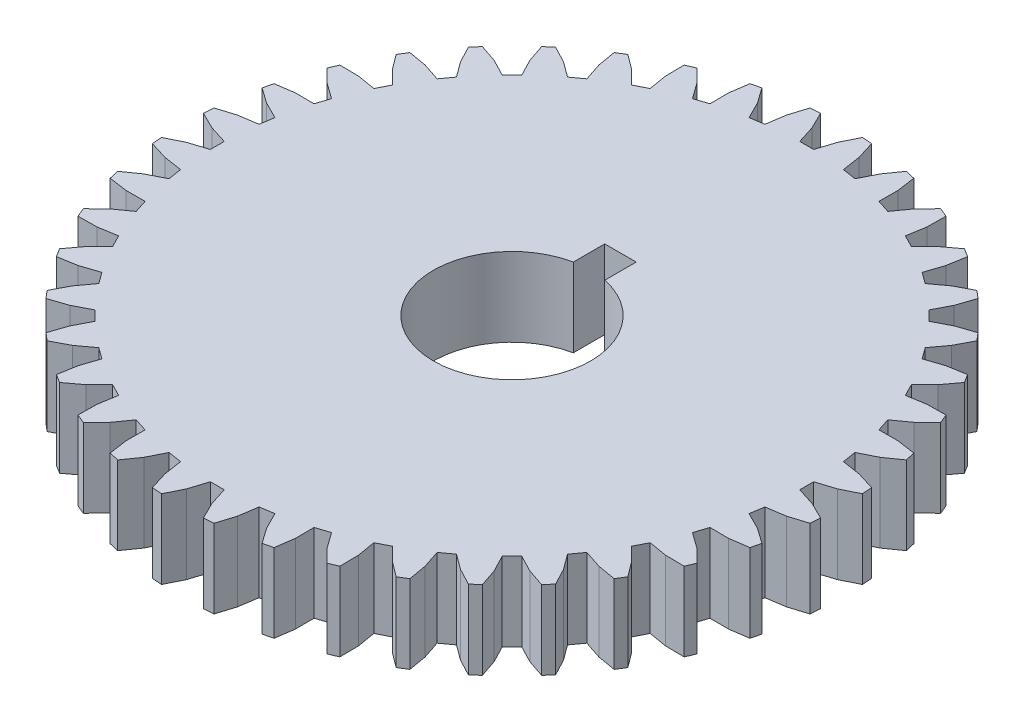
from build123d import *

# Parameters (mm, degrees)
EXTRUDE_1_DEPTH = 10


with BuildPart() as part:
    # 草图1 → 凸台-拉伸1 (new body)
    with BuildSketch(Plane(origin=(0, 0, 0), x_dir=(1, 0, 0), z_dir=(0, 1, 0))):
        Polygon((15.539064442, 62.864868962), (17.218272819, 62.319261086), (18.612038449, 64.263927027), (20.280202174, 65.979018289), (21.449660173, 65.494612926), (21.416477393, 63.102290381), (21.026932048, 60.741662779), (22.600114707, 59.940086178), (24.280933545, 61.642777073), (26.196858791, 63.075794416), (27.276141128, 62.414409349), (26.869125185, 60.056731196), (26.115092273, 57.786105155), (27.543512237, 56.748297304), (29.469996945, 58.167087253), (31.586507273, 59.282745034), (32.549038434, 58.46066576), (31.778211413, 56.195685858), (30.678257727, 54.070971726), (31.926742555, 52.822486899), (34.051456686, 53.922440585), (36.316436588, 54.693267606), (37.138515862, 53.730736445), (36.022858081, 51.614226117), (34.604068132, 49.687741408), (35.641875983, 48.259321445), (37.912502024, 49.013354357), (40.270180178, 49.420370299), (40.931565244, 48.341087963), (39.498547901, 46.425162717), (37.795857006, 44.744343879), (38.597433608, 43.17116122), (40.95806121, 43.560706565), (43.350383754, 43.593889345), (43.834789118, 42.424431346), (42.119697855, 40.756267621), (40.175031914, 39.362501991), (40.72063979, 37.683293614), (43.113142467, 37.698759494), (45.481202481, 37.357292041), (45.776700475, 36.126454317), (43.821766532, 34.747127839), (41.683009675, 33.674734553), (41.959214149, 31.930848142), (44.324680544, 31.571853735), (46.610168532, 30.864144111), (46.709483013, 29.602233971), (44.562843352, 28.545708337), (42.282658871, 27.821093277), (42.282658871, 26.055469102), (44.562843352, 25.330854041), (46.709483013, 24.274328407), (46.610168532, 23.012418267), (44.324680544, 22.304708644), (41.959214149, 21.945714237), (41.683009675, 20.201827825), (43.821766532, 19.129434539), (45.776700475, 17.750108062), (45.481202481, 16.519270337), (43.113142467, 16.177802885), (40.72063979, 16.193268765), (40.175031914, 14.514060387), (42.119697855, 13.120294758), (43.834789118, 11.452131033), (43.350383754, 10.282673033), (40.95806121, 10.315855813), (38.597433608, 10.705401159), (37.795857006, 9.1322185), (39.498547901, 7.451399661), (40.931565244, 5.535474416), (40.270180178, 4.456192079), (37.912502024, 4.863208021), (35.641875983, 5.617240933), (34.604068132, 4.18882097), (36.022858081, 2.262336262), (37.138515862, 0.145825934), (36.316436588, -0.816705228), (34.051456686, -0.045878206), (31.926742555, 1.05407548), (30.678257727, -0.194409348), (31.778211413, -2.319123479), (32.549038434, -4.584103381), (31.586507273, -5.406182655), (29.469996945, -4.290524874), (27.543512237, -2.871734925), (26.115092273, -3.909542776), (26.869125185, -6.180168818), (27.276141128, -8.537846971), (26.196858791, -9.199232038), (24.280933545, -7.766214694), (22.600114707, -6.063523799), (21.026932048, -6.865100401), (21.416477393, -9.225728003), (21.449660173, -11.618050547), (20.280202174, -12.102455911), (18.612038449, -10.387364648), (17.218272819, -8.442698708), (15.539064442, -8.988306584), (15.554530322, -11.38080926), (15.21306287, -13.748869275), (13.982225145, -14.044367268), (12.602898668, -12.089433325), (11.530505382, -9.950676468), (9.78661897, -10.226880942), (9.427624563, -12.592347337), (8.71991494, -14.877835325), (7.458004799, -14.977149807), (6.401479165, -12.830510145), (5.676864105, -10.550325664), (3.91123993, -10.550325664), (3.18662487, -12.830510145), (2.130099236, -14.977149807), (0.868189095, -14.877835325), (0.160479472, -12.592347337), (-0.198514935, -10.226880942), (-1.942401347, -9.950676468), (-3.014794633, -12.089433325), (-4.39412111, -14.044367268), (-5.624958835, -13.748869275), (-5.966426287, -11.38080926), (-5.950960407, -8.988306584), (-7.630168784, -8.442698708), (-9.023934414, -10.387364648), (-10.692098139, -12.102455911), (-11.861556138, -11.618050547), (-11.828373358, -9.225728003), (-11.438828013, -6.865100401), (-13.012010672, -6.063523799), (-14.69282951, -7.766214694), (-16.608754756, -9.199232038), (-17.688037093, -8.537846971), (-17.28102115, -6.180168818), (-16.526988238, -3.909542776), (-17.955408202, -2.871734925), (-19.88189291, -4.290524874), (-21.998403238, -5.406182655), (-22.960934399, -4.584103381), (-22.190107378, -2.319123479), (-21.090153692, -0.194409348), (-22.33863852, 1.05407548), (-24.463352651, -0.045878206), (-26.728332553, -0.816705228), (-27.550411827, 0.145825934), (-26.434754046, 2.262336262), (-25.015964097, 4.18882097), (-26.053771948, 5.617240933), (-28.324397989, 4.863208021), (-30.682076143, 4.456192079), (-31.343461209, 5.535474416), (-29.910443866, 7.451399661), (-28.207752971, 9.1322185), (-29.009329573, 10.705401159), (-31.369957175, 10.315855813), (-33.762279719, 10.282673033), (-34.246685083, 11.452131033), (-32.53159382, 13.120294758), (-30.586927879, 14.514060387), (-31.132535755, 16.193268765), (-33.525038432, 16.177802885), (-35.893098446, 16.519270337), (-36.18859644, 17.750108062), (-34.233662497, 19.129434539), (-32.09490564, 20.201827825), (-32.371110114, 21.945714237), (-34.736576509, 22.304708644), (-37.022064497, 23.012418267), (-37.121378978, 24.274328407), (-34.974739317, 25.330854041), (-32.694554836, 26.055469102), (-32.694554836, 27.821093277), (-34.974739317, 28.545708337), (-37.121378978, 29.602233971), (-37.022064497, 30.864144111), (-34.736576509, 31.571853735), (-32.371110114, 31.930848142), (-32.09490564, 33.674734553), (-34.233662497, 34.747127839), (-36.18859644, 36.126454317), (-35.893098446, 37.357292041), (-33.525038432, 37.698759494), (-31.132535755, 37.683293614), (-30.586927879, 39.362501991), (-32.53159382, 40.756267621), (-34.246685083, 42.424431346), (-33.762279719, 43.593889345), (-31.369957175, 43.560706565), (-29.009329573, 43.17116122), (-28.207752971, 44.744343879), (-29.910443866, 46.425162717), (-31.343461209, 48.341087963), (-30.682076143, 49.420370299), (-28.324397989, 49.013354357), (-26.053771948, 48.259321445), (-25.015964097, 49.687741408), (-26.434754046, 51.614226117), (-27.550411827, 53.730736445), (-26.728332553, 54.693267606), (-24.463352651, 53.922440585), (-22.33863852, 52.822486899), (-21.090153692, 54.070971726), (-22.190107378, 56.195685858), (-22.960934399, 58.46066576), (-21.998403238, 59.282745034), (-19.88189291, 58.167087253), (-17.955408202, 56.748297304), (-16.526988238, 57.786105155), (-17.28102115, 60.056731196), (-17.688037093, 62.414409349), (-16.608754756, 63.075794416), (-14.69282951, 61.642777073), (-13.012010672, 59.940086178), (-11.438828013, 60.741662779), (-11.828373358, 63.102290381), (-11.861556138, 65.494612926), (-10.692098139, 65.979018289), (-9.023934414, 64.263927027), (-7.630168784, 62.319261086), (-5.950960407, 62.864868962), (-5.966426287, 65.257371639), (-5.624958835, 67.625431653), (-4.39412111, 67.920929647), (-3.014794633, 65.965995704), (-1.942401347, 63.827238847), (-0.198514935, 64.10344332), (0.160479472, 66.468909716), (0.868189095, 68.754397703), (2.130099236, 68.853712185), (3.18662487, 66.707072524), (3.91123993, 64.426888043), (5.676864105, 64.426888043), (6.401479165, 66.707072524), (7.458004799, 68.853712185), (8.71991494, 68.754397703), (9.427624563, 66.468909716), (9.78661897, 64.10344332), (11.530505382, 63.827238847), (12.602898668, 65.965995704), (13.982225145, 67.920929647), (15.21306287, 67.625431653), (15.554530322, 65.257371639), align=None)
        with BuildLine():
            Line((6.794052018, 36.73624016), (6.794052018, 40.73624016))
            Line((6.794052018, 40.73624016), (2.794052018, 40.73624016))
            Line((2.794052018, 40.73624016), (2.794052018, 36.73624016))
            ThreePointArc((2.794052018, 36.73624016), (4.794052018, 16.938281189), (6.794052018, 36.73624016))
        make_face(mode=Mode.SUBTRACT)
    extrude(amount=EXTRUDE_1_DEPTH)


solid = part.part
